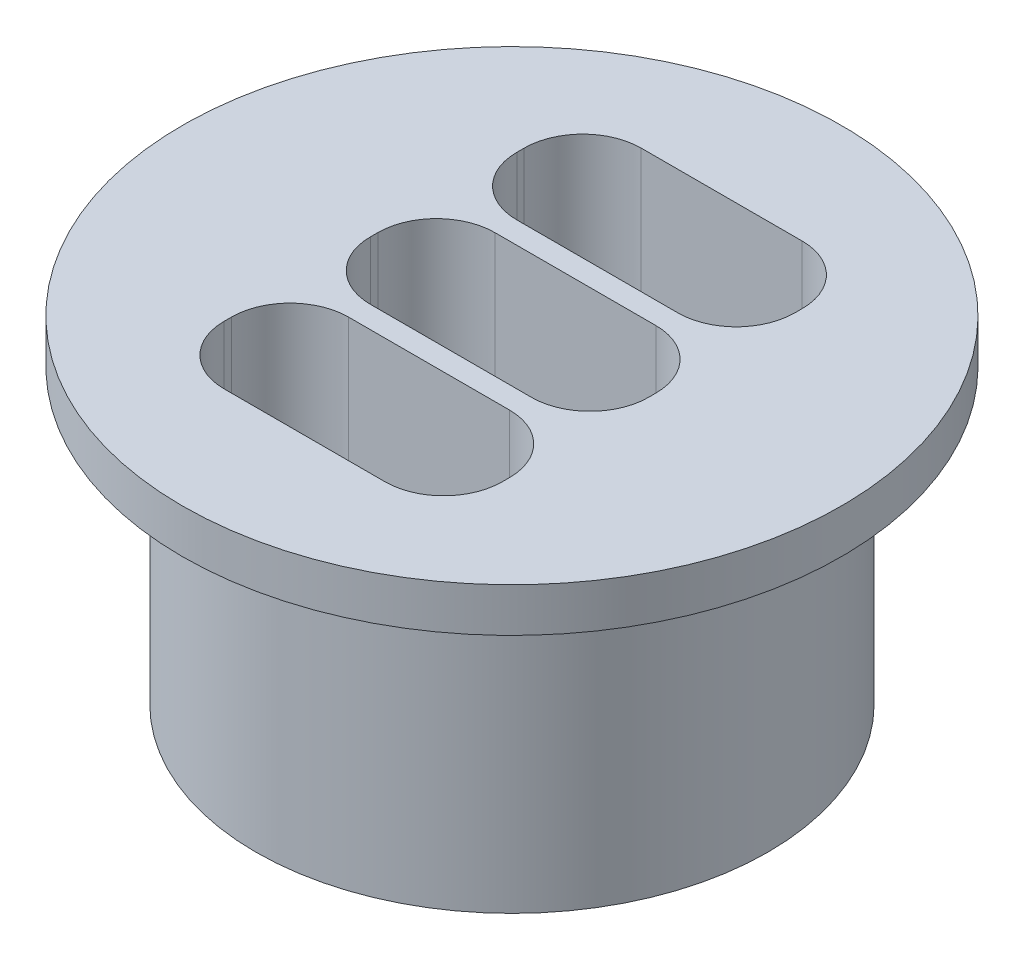
from build123d import *

# Parameters (mm, degrees)
SKETCH1_R           = 17.5
BOSS_EXTRUDE1_DEPTH = 20
SKETCH2_R           = 21.5
BOSS_EXTRUDE2_DEPTH = 3
SKETCH3_W           = 19
SKETCH3_H           = 8.5
CUT_EXTRUDE3_DEPTH  = 23
FILLET11_R          = 4
FILLET12_R          = 4
BOSS_EXTRUDE4_START = -3
SKETCH6_R           = 22.520770935
SKETCH6_R_2         = 21.5
BOSS_EXTRUDE4_DEPTH = 3


with BuildPart() as part:
    # Sketch1 → Boss-Extrude1 (new body)
    with BuildSketch(Plane(origin=(0, 0, 0), x_dir=(1, 0, 0), z_dir=(0, 1, 0))):
        with Locations(Location((0, 0, 0), (0, 0, 270))):
            Circle(SKETCH1_R)
    extrude(amount=BOSS_EXTRUDE1_DEPTH)

    # Sketch2 → Boss-Extrude2 (add)
    with BuildSketch(Plane(origin=(0, 20, 0), x_dir=(1, 0, 0), z_dir=(0, 1, 0))):
        with Locations(Location((0, 0, 0), (0, 0, 270))):
            Circle(SKETCH2_R)
    extrude(amount=BOSS_EXTRUDE2_DEPTH)

    # Sketch3 → Cut-Extrude3 (cut)
    with BuildSketch(Plane(origin=(0, 23, 0), x_dir=(1, 0, 0), z_dir=(0, 1, 0))):
        with Locations((0, 0.083811037)):
            Rectangle(SKETCH3_W, SKETCH3_H)
        with Locations((0, 10.083811037)):
            Rectangle(SKETCH3_W, SKETCH3_H)
        with Locations((0, -9.916188963)):
            Rectangle(SKETCH3_W, SKETCH3_H)
    extrude(amount=-CUT_EXTRUDE3_DEPTH, mode=Mode.SUBTRACT)

    # Fillet11
    fillet11_edges = [part.edges().sort_by_distance(p)[0] for p in [
        (9.5, 11.5, 4.166188963),
        (-9.5, 11.5, 4.166188963),
        (-9.5, 11.5, -4.333811037),
        (9.5, 11.5, -4.333811037),
        (9.5, 11.5, 14.166188963),
        (-9.5, 11.5, 14.166188963),
        (-9.5, 11.5, 5.666188963),
        (9.5, 11.5, 5.666188963),
    ]]
    fillet(fillet11_edges, radius=FILLET11_R)

    # Fillet12
    fillet12_edges = [part.edges().sort_by_distance(p)[0] for p in [
        (9.5, 11.5, -14.333811037),
        (9.5, 11.5, -5.833811037),
        (-9.5, 11.5, -5.833811037),
        (-9.5, 11.5, -14.333811037),
    ]]
    fillet(fillet12_edges, radius=FILLET12_R)

    # Sketch6 → Boss-Extrude4 (add)
    with BuildSketch(Plane(origin=(0, 23, 0), x_dir=(1, 0, 0), z_dir=(0, 1, 0)).offset(BOSS_EXTRUDE4_START)):
        with Locations(Location((0, 0, 0), (0, 0, 270))):
            Circle(SKETCH6_R)
        Circle(SKETCH6_R_2, mode=Mode.SUBTRACT)
    extrude(amount=BOSS_EXTRUDE4_DEPTH)


solid = part.part
